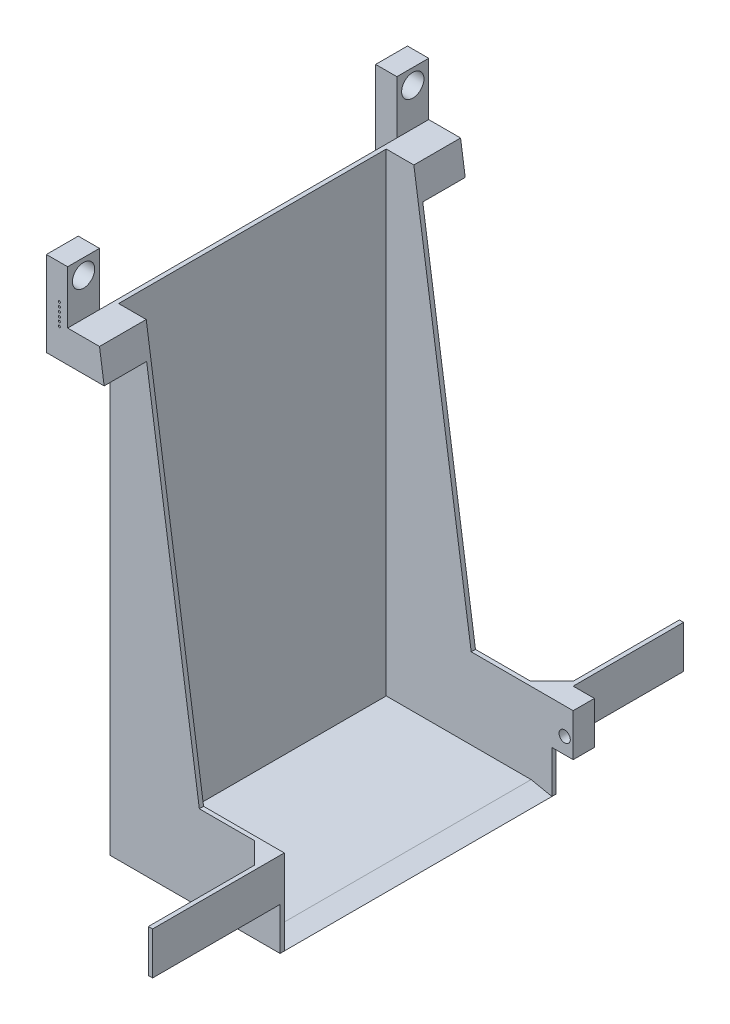
from build123d import *

# Parameters (mm, degrees)
BOSS_EXTRUDE2_DEPTH = 65
CUT_EXTRUDE1_DEPTH  = 63
BOSS_EXTRUDE6_DEPTH = 20
SKETCH26_W          = 15
SKETCH26_H          = 40
BOSS_EXTRUDE7_DEPTH = 10
SKETCH27_R          = 0.5
CUT_EXTRUDE3_DEPTH  = 5
SKETCH29_R          = 5.25
CUT_EXTRUDE4_DEPTH  = 10
SKETCH30_W          = 2
SKETCH30_H          = 20
BOSS_EXTRUDE8_DEPTH = 60
CHAMFER1_SIZE       = 10
SKETCH32_W          = 10
SKETCH32_H          = 20
BOSS_EXTRUDE9_DEPTH = 10
SKETCH33_R          = 2.65
CUT_EXTRUDE5_DEPTH  = 10


with BuildPart() as part:
    # Sketch2 → Boss-Extrude2 (new, symmetric)
    with BuildSketch(Plane.XY):
        Polygon((15, 225), (0, 225), (0, 0), (80, 0), (80, 40), (42, 40), align=None)
    extrude(amount=BOSS_EXTRUDE2_DEPTH, both=True)

    # Sketch5 → Cut-Extrude1 (cut, symmetric)
    with BuildSketch(Plane.XY):
        Polygon((2, 2), (70.202041029, 2), (80, 0), (80, 40), (42, 40), (15, 225), (2, 225), align=None)
    extrude(amount=CUT_EXTRUDE1_DEPTH, both=True, mode=Mode.SUBTRACT)

    # Sketch25 → Boss-Extrude6 (add)
    with BuildSketch(Plane.XY.offset(65)):
        Polygon((17.189189189, 210), (15, 225), (0, 225), (0, 210), align=None)
    extrude(amount=BOSS_EXTRUDE6_DEPTH)

    # Sketch26 → Boss-Extrude7 (add)
    with BuildSketch(Plane.ZY):
        with Locations((77.5, 230)):
            Rectangle(SKETCH26_W, SKETCH26_H)
    extrude(amount=BOSS_EXTRUDE7_DEPTH)

    # Sketch27 → Cut-Extrude3 (cut)
    with BuildSketch(Plane.XY.offset(85)):
        with Locations((-3.905405405, 231.7)):
            Circle(SKETCH27_R)
        with Locations((-3.905405405, 233.7)):
            Circle(SKETCH27_R)
        with Locations((-3.905405405, 229.7)):
            Circle(SKETCH27_R)
        with Locations((-3.905405405, 227.7)):
            Circle(SKETCH27_R)
        with Locations((-3.905405405, 225.7)):
            Circle(SKETCH27_R)
        with Locations((-3.905405405, 223.7)):
            Circle(SKETCH27_R)
    extrude(amount=-CUT_EXTRUDE3_DEPTH, mode=Mode.SUBTRACT)

    # Sketch29 → Cut-Extrude4 (cut)
    with BuildSketch(Plane(origin=(0, 0, 0), x_dir=(0, 0, -1), z_dir=(1, 0, 0))):
        with Locations((-77.5, 242.75)):
            Circle(SKETCH29_R)
    extrude(amount=-CUT_EXTRUDE4_DEPTH, mode=Mode.SUBTRACT)

    # Sketch30 → Boss-Extrude8 (add)
    with BuildSketch(Plane.XY.offset(65)):
        with Locations((79, 30)):
            Rectangle(SKETCH30_W, SKETCH30_H)
    extrude(amount=BOSS_EXTRUDE8_DEPTH)

    # Chamfer1
    chamfer1_edges = [part.edges().sort_by_distance(p)[0] for p in [
        (78, 30, 65),
    ]]
    chamfer(chamfer1_edges, length=CHAMFER1_SIZE)

    # Mirror3: part across plane


with BuildPart() as part_1:
    add(part.part)
    add(part.part.mirror(Plane(origin=(0, 0, 0), x_dir=(1, 0, 0), z_dir=(0, 0, -1))))

    # Sketch32 → Boss-Extrude9 (add)
    with BuildSketch(Plane(origin=(80, 0, 0), x_dir=(0, 0, -1), z_dir=(1, 0, 0))):
        with Locations((68, 30)):
            Rectangle(SKETCH32_W, SKETCH32_H)
    extrude(amount=BOSS_EXTRUDE9_DEPTH)

    # Sketch33 → Cut-Extrude5 (cut)
    with BuildSketch(Plane.XY.offset(-63)):
        with Locations((86, 27.5)):
            Circle(SKETCH33_R)
    extrude(amount=-CUT_EXTRUDE5_DEPTH, mode=Mode.SUBTRACT)


solid = part_1.part
